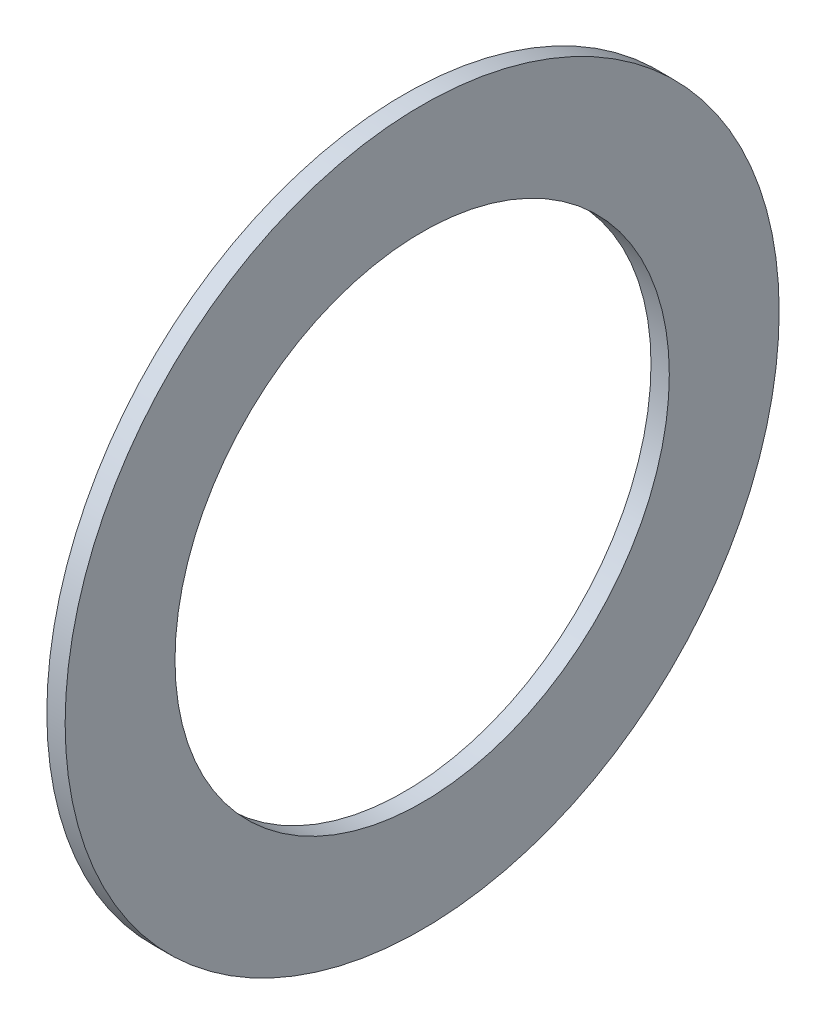
from build123d import *

# Parameters (mm, degrees)
AXIAL_PROFILE_MM_W = 2
AXIAL_PROFILE_MM_H = 12


with BuildPart() as part:
    # Axial profile (mm) → Full revolution (revolve)
    with BuildSketch(Plane.XY, mode=Mode.PRIVATE) as full_revolution_sk:
        with Locations((134.7, 33)):
            Rectangle(AXIAL_PROFILE_MM_W, AXIAL_PROFILE_MM_H)
    revolve(full_revolution_sk.sketch.rotate(Axis((-110, 0, 0), (1, 0, 0)), 90), axis=Axis((-110, 0, 0), (1, 0, 0)))


solid = part.part
